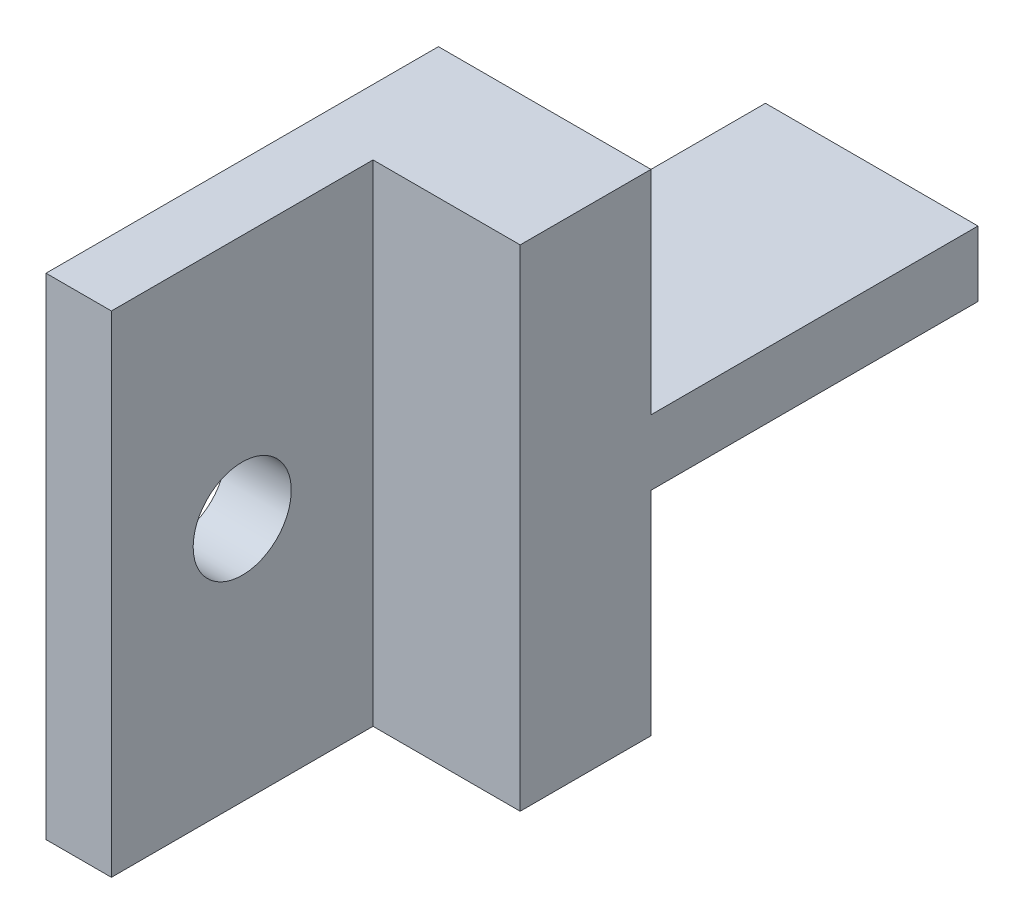
from build123d import *

# Parameters (mm, degrees)
SKETCH1_W           = 30
SKETCH1_H           = 15
BOSS_EXTRUDE1_DEPTH = 2
SKETCH2_W           = 6.5
SKETCH2_H           = 15
BOSS_EXTRUDE2_DEPTH = 4
SKETCH3_W           = 6.5
SKETCH3_H           = 2
BOSS_EXTRUDE3_DEPTH = 10
SKETCH4_R           = 2
CUT_EXTRUDE2_DEPTH  = 5
BOSS_EXTRUDE4_START = 5
SKETCH5_R           = 3.5
SKETCH5_R_2         = 2
BOSS_EXTRUDE4_DEPTH = 5
SKETCH6_W           = 22
SKETCH6_H           = 15
CUT_EXTRUDE3_DEPTH  = 10
SKETCH7_R           = 1.5
CUT_EXTRUDE4_DEPTH  = 10


with BuildPart() as part:
    # Sketch1 → Boss-Extrude1 (new body)
    with BuildSketch(Plane(origin=(0, 0, 0), x_dir=(0, 0, -1), z_dir=(1, 0, 0))):
        with Locations((15, 7.5)):
            Rectangle(SKETCH1_W, SKETCH1_H)
    extrude(amount=BOSS_EXTRUDE1_DEPTH)

    # Sketch2 → Boss-Extrude2 (add)
    with BuildSketch(Plane(origin=(0, 0, -30), x_dir=(-1, 0, 0), z_dir=(0, 0, -1))):
        with Locations((-3.25, 7.5)):
            Rectangle(SKETCH2_W, SKETCH2_H)
    extrude(amount=BOSS_EXTRUDE2_DEPTH)

    # Sketch3 → Boss-Extrude3 (add)
    with BuildSketch(Plane(origin=(0, 0, -34), x_dir=(-1, 0, 0), z_dir=(0, 0, -1))):
        with Locations((-3.25, 7.5)):
            Rectangle(SKETCH3_W, SKETCH3_H)
    extrude(amount=BOSS_EXTRUDE3_DEPTH)

    # Sketch4 → Cut-Extrude2 (cut)
    with BuildSketch(Plane(origin=(2, 0, 0), x_dir=(0, 0, -1), z_dir=(1, 0, 0))):
        with Locations((10, 7.5)):
            Circle(SKETCH4_R)
    extrude(amount=-CUT_EXTRUDE2_DEPTH, mode=Mode.SUBTRACT)

    # Sketch5 → Boss-Extrude4 (add)
    with BuildSketch(Plane(origin=(2, 0, 0), x_dir=(0, 0, -1), z_dir=(1, 0, 0)).offset(BOSS_EXTRUDE4_START)):
        with Locations(Location((10, 7.5, 0), (0, 0, 180))):
            Circle(SKETCH5_R)
        with Locations((10, 7.5)):
            Circle(SKETCH5_R_2, mode=Mode.SUBTRACT)
    extrude(amount=-BOSS_EXTRUDE4_DEPTH)

    # Sketch6 → Cut-Extrude3 (cut)
    with BuildSketch(Plane.ZY):
        with Locations((-11, 7.5)):
            Rectangle(SKETCH6_W, SKETCH6_H)
    extrude(amount=-CUT_EXTRUDE3_DEPTH, mode=Mode.SUBTRACT)

    # Sketch7 → Cut-Extrude4 (cut)
    with BuildSketch(Plane.ZY):
        with Locations((-26, 7.5)):
            Circle(SKETCH7_R)
    extrude(amount=-CUT_EXTRUDE4_DEPTH, mode=Mode.SUBTRACT)


solid = part.part
